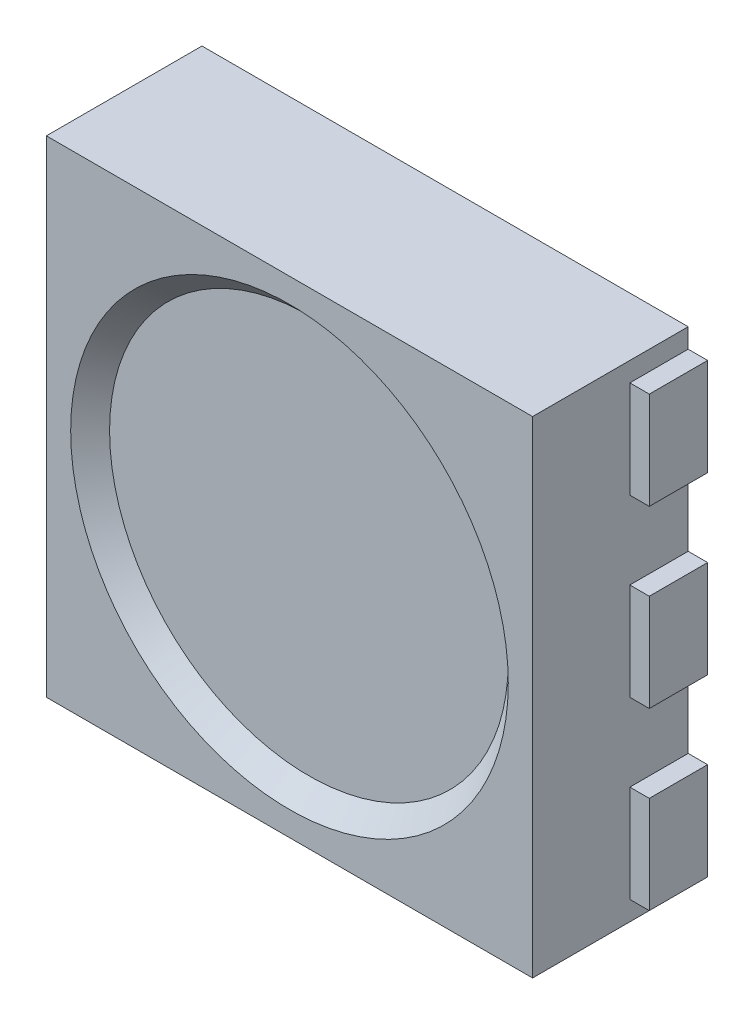
from build123d import *

# Parameters (mm, degrees)
SKETCH1_W           = 5
SKETCH1_H           = 5
BOSS_EXTRUDE1_DEPTH = 1.6
SKETCH2_R           = 2.25
CUT_EXTRUDE1_DEPTH  = 0.2
CUT_EXTRUDE1_DRAFT  = -45
SKETCH3_W           = 0.2
SKETCH3_H           = 1
BOSS_EXTRUDE2_DEPTH = 0.6


with BuildPart() as part:
    # Sketch1 → Boss-Extrude1 (new body)
    with BuildSketch(Plane.XY):
        Rectangle(SKETCH1_W, SKETCH1_H)
    extrude(amount=BOSS_EXTRUDE1_DEPTH)


with BuildPart() as cut_extrude1_tool:
    # Sketch2 → Cut-Extrude1 (with draft: the straight prism first)
    with BuildSketch(Plane.XY.offset(1.6)):
        Circle(SKETCH2_R)
    extrude(amount=-CUT_EXTRUDE1_DEPTH)
    # Cut-Extrude1: the draft: its side faces are tilted about the plane it starts from
    cut_extrude1_sides = [cut_extrude1_tool.faces().sort_by_distance(p)[0] for p in [
        (-2.25, 0, 1.5),
    ]]
    draft(cut_extrude1_sides, Plane.XY.offset(1.6), CUT_EXTRUDE1_DRAFT)


with BuildPart() as part_1:
    add(part.part)

    # Cut-Extrude1: cut by cut_extrude1_tool
    add(cut_extrude1_tool.part, mode=Mode.SUBTRACT)

    # Sketch3 → Boss-Extrude2 (add)
    with BuildSketch(Plane.XY):
        with Locations((-2.6, 1.8)):
            Rectangle(SKETCH3_W, SKETCH3_H)
        with Locations((2.6, 1.8)):
            Rectangle(SKETCH3_W, SKETCH3_H)
        with Locations((2.6, -1.8)):
            Rectangle(SKETCH3_W, SKETCH3_H)
        with Locations((-2.6, -1.8)):
            Rectangle(SKETCH3_W, SKETCH3_H)
        with Locations((2.6, 0)):
            Rectangle(SKETCH3_W, SKETCH3_H)
        with Locations((-2.6, 0)):
            Rectangle(SKETCH3_W, SKETCH3_H)
    extrude(amount=BOSS_EXTRUDE2_DEPTH)


solid = part_1.part
